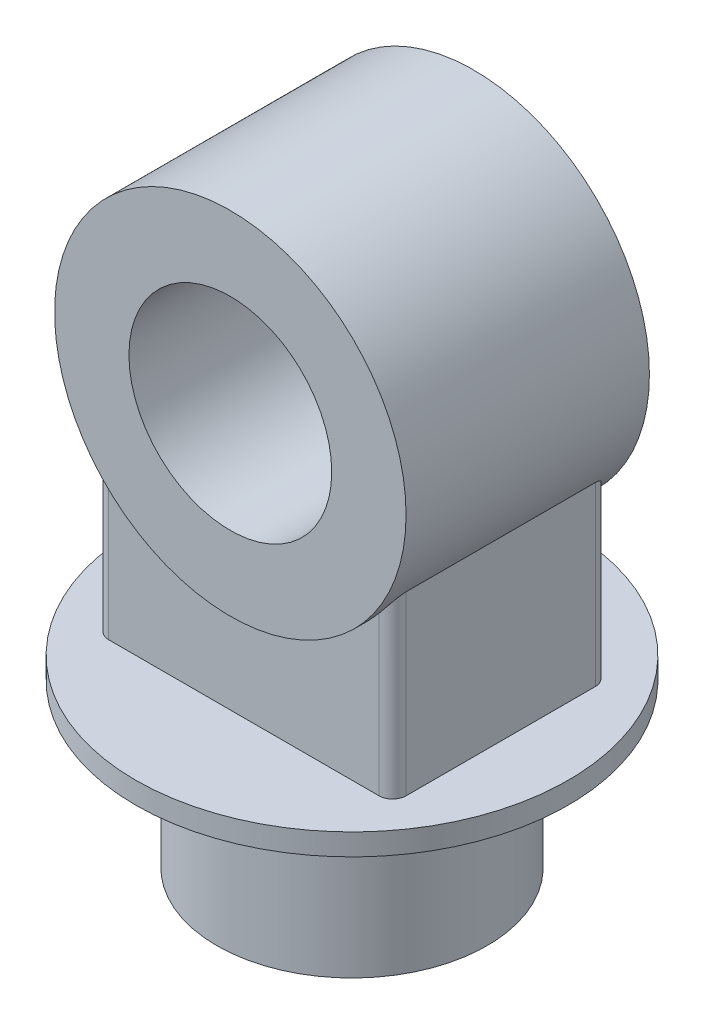
from build123d import *

# Parameters (mm, degrees)
SKETCH2_R                = 100
BOSS_EXTRUDE1_DEPTH      = 120
SKETCH3_R                = 160
BOSS_EXTRUDE2_DEPTH      = 16
SKETCH7_R                = 130
SKETCH7_R_2              = 75
BOSS_EXTRUDE3_DEPTH      = 90
BOSS_EXTRUDE4_REACH      = 402.125
BOSS_EXTRUDE4_END_RADIUS = 130
SKETCH8_W                = 220
SKETCH8_H                = 160
FILLET1_R                = 10


with BuildPart() as part:
    # Sketch2 → Boss-Extrude1 (new body)
    with BuildSketch(Plane(origin=(0, 0, 0), x_dir=(1, 0, 0), z_dir=(0, 1, 0))):
        with Locations(Location((0, 0, 0), (0, 0, 270))):
            Circle(SKETCH2_R)
    extrude(amount=BOSS_EXTRUDE1_DEPTH)

    # Sketch3 → Boss-Extrude2 (add)
    with BuildSketch(Plane(origin=(0, 120, 0), x_dir=(1, 0, 0), z_dir=(0, 1, 0))):
        with Locations(Location((0, 0, 0), (0, 0, 270))):
            Circle(SKETCH3_R)
    extrude(amount=BOSS_EXTRUDE2_DEPTH)



with BuildPart() as body_2:
    # Sketch7 → Boss-Extrude3 (new, symmetric)
    with BuildSketch(Plane.XY):
        with Locations(Location((0, 336, 0), (0, 0, 180))):
            Circle(SKETCH7_R)
        with Locations(Location((0, 336, 0), (0, 0, 180))):
            Circle(SKETCH7_R_2, mode=Mode.SUBTRACT)
    extrude(amount=BOSS_EXTRUDE3_DEPTH, both=True)


with BuildPart() as part_1:
    add(part.part)

    add(body_2.part)  # Boss-Extrude4 merges body 2
    # Boss-Extrude4: up to this cylinder (the profile starts outside it)
    boss_extrude4_end = Plane(origin=(0, 336, 0), z_dir=(0, 0, -1)) * Cylinder(BOSS_EXTRUDE4_END_RADIUS, 1065.25, mode=Mode.PRIVATE)
    # Sketch8 → Boss-Extrude4 (add, up to the surface)
    with BuildSketch(Plane(origin=(0, 136, 0), x_dir=(1, 0, 0), z_dir=(0, 1, 0)), mode=Mode.PRIVATE) as boss_extrude4_sk1:
        Rectangle(SKETCH8_W, SKETCH8_H)
    boss_extrude4_tool1 = extrude(boss_extrude4_sk1.sketch, amount=BOSS_EXTRUDE4_REACH, mode=Mode.PRIVATE) - boss_extrude4_end
    add(boss_extrude4_tool1.solids().sort_by_distance((0, 136, 0))[0])

    # Fillet1
    fillet1_edges = [part_1.edges().sort_by_distance(p)[0] for p in [
        (-110, 201.358983849, 80),
        (-110, 201.358983849, -80),
        (110, 201.358983849, 80),
        (110, 201.358983849, -80),
    ]]
    fillet(fillet1_edges, radius=FILLET1_R)


solid = part_1.part
